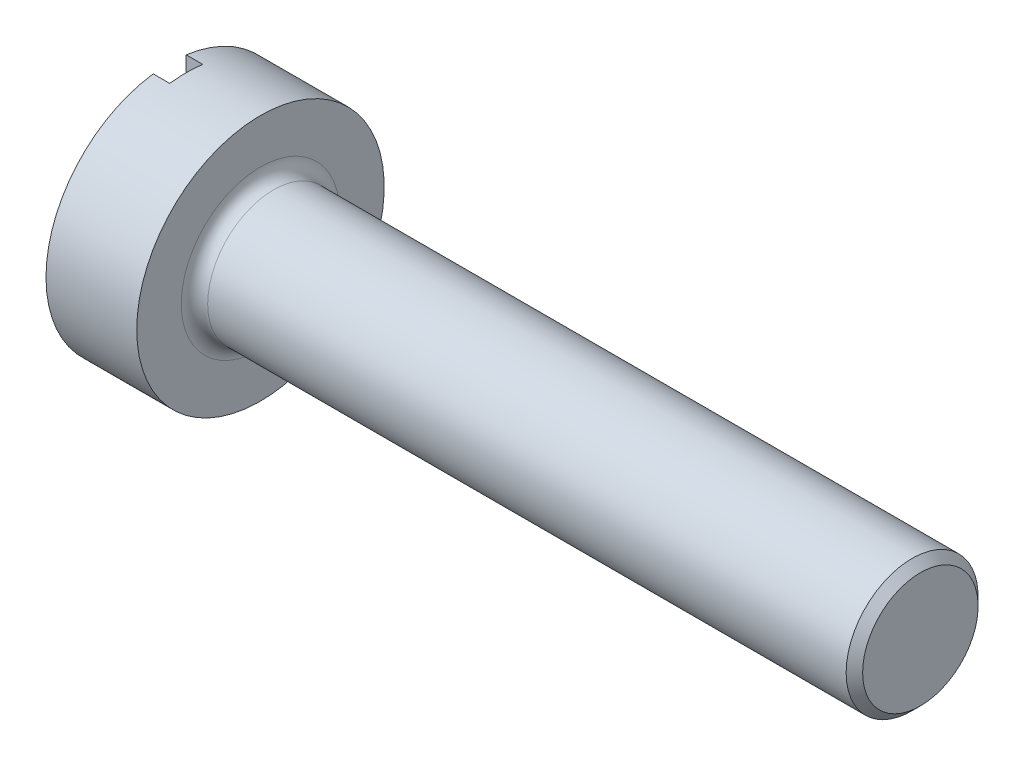
from build123d import *

# Parameters (mm, degrees)
SKETCH1_W           = 8
SKETCH1_H           = 0.8
CHAMFER1_SIZE       = 0.1
FILLET1_R           = 0.16
EXTRUDE1_DEPTH      = 10.343982021
EXTRUDE1_DEPTH_BACK = 10.343982021
SKETCH2_W           = 0.2
SKETCH2_H           = 0.2


with BuildPart() as part:
    # Sketch1 → Revolve1 (revolve)
    with BuildSketch(Plane.XY, mode=Mode.PRIVATE) as revolve1_sk:
        Polygon((0, 1.5), (0, 0), (1.1, 0), (1.1, 0.8), (1.1, 1.5), align=None)
        with Locations((5.1, 0.4)):
            Rectangle(SKETCH1_W, SKETCH1_H)
    revolve(revolve1_sk.sketch.rotate(Axis((0, 0, 0), (1, 0, 0)), 90), axis=Axis((0, 0, 0), (1, 0, 0)))

    # Chamfer1
    chamfer1_edges = [part.edges().sort_by_distance(p)[0] for p in [
        (9.1, 0, -0.8),
    ]]
    chamfer(chamfer1_edges, length=CHAMFER1_SIZE)

    # Fillet1
    fillet1_edges = [part.edges().sort_by_distance(p)[0] for p in [
        (1.1, 0, -0.8),
    ]]
    fillet(fillet1_edges, radius=FILLET1_R)

    # Sketch2 → Extrude1 (cut, two sides: drawn at the far end of the back side and taken through both)
    with BuildSketch(Plane(origin=(0, 0, 0), x_dir=(1, 0, 0), z_dir=(0, 1, 0)).offset(-EXTRUDE1_DEPTH_BACK)):
        with Locations((0.1, -0.1)):
            Rectangle(SKETCH2_W, SKETCH2_H)
        with Locations((0.1, 0.1)):
            Rectangle(SKETCH2_W, SKETCH2_H)
    extrude(amount=EXTRUDE1_DEPTH + EXTRUDE1_DEPTH_BACK, mode=Mode.SUBTRACT)


solid = part.part
